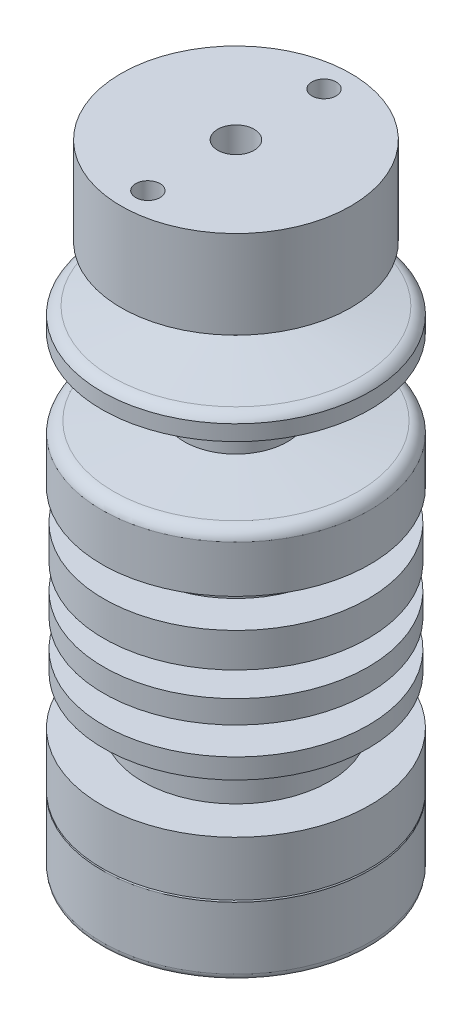
from build123d import *

# Parameters (mm, degrees)
CROQUIS5_R              = 7.9375
CORTAR_EXTRUIR3_DEPTH   = 18
CROQUIS9_R              = 3.175
CORTAR_EXTRUIR5_DEPTH   = 18
CROQUIS10_R             = 4.765
CORTAR_EXTRUIR6_DEPTH   = 35
CROQUIS11_R             = 35
SALIENTE_EXTRUIR1_DEPTH = 14.24


with BuildPart() as part:
    # Croquis1 → Revolución3 (revolve)
    with BuildSketch(Plane.XY, mode=Mode.PRIVATE) as revoluci_n3_sk:
        with BuildLine():
            Line((0, 43.044568245), (30, 43.044568245))
            Line((30, 43.044568245), (30, 20.044568245))
            Line((30, 20.044568245), (12.985796912, 20.044568245))
            Line((12.985796912, 20.044568245), (12.985796912, 10.406207601))
            ThreePointArc((12.985796912, 10.406207601), (13.175212613, 9.391052882), (13.717969076, 8.512512712))
            Line((13.717969076, 8.512512712), (32.309744815, 5.485961945))
            ThreePointArc((32.309744815, 5.485961945), (33.884795273, 4.831882369), (35, 3.541563627))
            Line((35, 3.541563627), (35, -0.490098714))
            Line((35, -0.490098714), (13.468735488, -0.490098714))
            Line((13.468735488, -0.490098714), (13.468735488, -18.538757946))
            Line((13.468735488, -18.538757946), (31.979226627, -20.513196287))
            ThreePointArc((31.979226627, -20.513196287), (33.927671218, -21.380602851), (35, -23.224224681))
            Line((35, -23.224224681), (35, -35.501069654))
            Line((35, -35.501069654), (24.334695592, -35.501069654))
            Line((24.334695592, -35.501069654), (24.334695592, -43.520130292))
            Line((24.334695592, -43.520130292), (34.538342083, -43.520130292))
            Line((34.538342083, -43.520130292), (34.538342083, -52.477142798))
            Line((34.538342083, -52.477142798), (24.334695592, -52.477142798))
            Line((24.334695592, -52.477142798), (24.334695592, -58.946096275))
            Line((24.334695592, -58.946096275), (34.538342083, -58.946096275))
            Line((34.538342083, -58.946096275), (34.538342083, -64.917437946))
            Line((34.538342083, -64.917437946), (24.334695592, -64.917437946))
            Line((24.334695592, -64.917437946), (24.334695592, -72.132809132))
            Line((24.334695592, -72.132809132), (34.538342083, -72.132809132))
            Line((34.538342083, -72.132809132), (34.538342083, -77.357733094))
            Line((34.538342083, -77.357733094), (24.334695592, -77.357733094))
            Line((24.334695592, -77.357733094), (24.334695592, -104.221668074))
            Line((24.334695592, -104.221668074), (34.538342083, -104.221668074))
            ThreePointArc((34.538342083, -104.221668074), (34.864783527, -104.356884547), (35, -104.683325991))
            Line((35, -104.683325991), (35, -120.950877143))
            ThreePointArc((35, -120.950877143), (34.933442046, -121.487214162), (34.737806004, -121.991013624))
            Line((34.737806004, -121.991013624), (0, -121.955431755))
            Line((0, -121.955431755), (0, 43.044568245))
        make_face()
    revolve(revoluci_n3_sk.sketch.rotate(Axis((0, 43.044568245, 0), (0, -1, 0)), 180), axis=Axis((0, 43.044568245, 0), (0, -1, 0)))

    # Croquis5 → Cortar-Extruir3 (cut)
    with BuildSketch(Plane(origin=(0, -104.221668074, 0), x_dir=(1, 0, 0), z_dir=(0, 1, 0))):
        with Locations(Location((0.097949209, 0, 0), (0, 0, 270))):
            Circle(CROQUIS5_R)
    extrude(amount=-CORTAR_EXTRUIR3_DEPTH, mode=Mode.SUBTRACT)

    # Croquis9 → Cortar-Extruir5 (cut)
    with BuildSketch(Plane(origin=(0, 43.044568245, 0), x_dir=(1, 0, 0), z_dir=(0, 1, 0))):
        with Locations(Location((0, 23, 0), (0, 0, 180))):
            Circle(CROQUIS9_R)
        with Locations(Location((0, -23, 0), (0, 0, 180))):
            Circle(CROQUIS9_R)
    extrude(amount=-CORTAR_EXTRUIR5_DEPTH, mode=Mode.SUBTRACT)

    # Croquis10 → Cortar-Extruir6 (cut)
    with BuildSketch(Plane(origin=(0, 43.044568245, 0), x_dir=(1, 0, 0), z_dir=(0, 1, 0))):
        with Locations(Location((0, 0, 0), (0, 0, 180))):
            Circle(CROQUIS10_R)
    extrude(amount=-CORTAR_EXTRUIR6_DEPTH, mode=Mode.SUBTRACT)

    # Croquis11 → Saliente-Extruir1 (add)
    with BuildSketch(Plane(origin=(0, -104.221668074, 0), x_dir=(1, 0, 0), z_dir=(0, 1, 0))):
        with Locations(Location((0, 0, 0), (0, 0, 180))):
            Circle(CROQUIS11_R)
    extrude(amount=SALIENTE_EXTRUIR1_DEPTH)


solid = part.part
